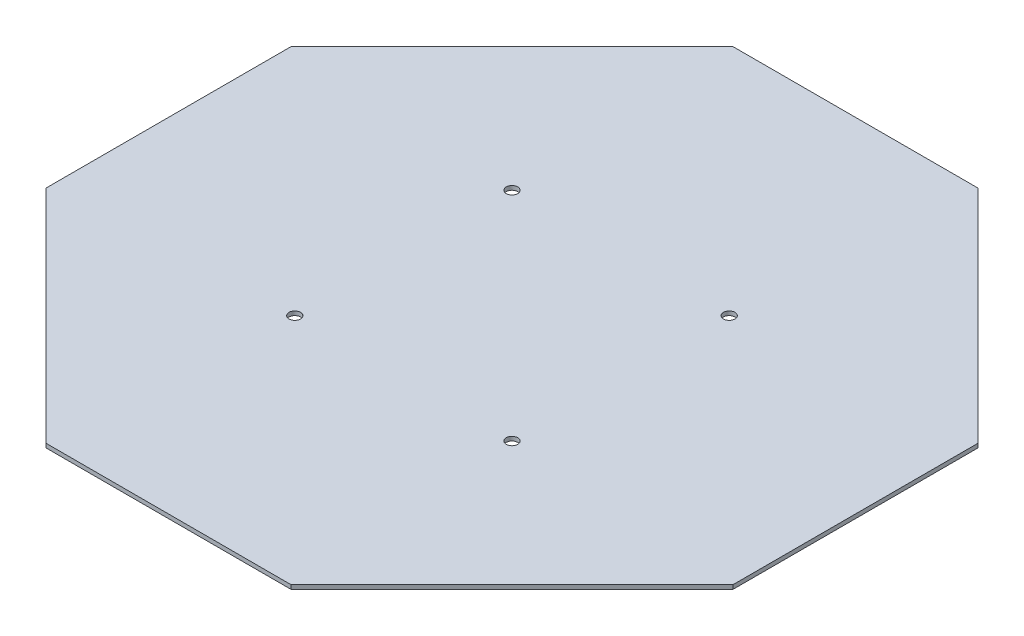
from build123d import *

# Parameters (mm, degrees)
BOSS_EXTRUDE1_DEPTH     = 3
CUT_EXTRUDE1_DEPTH      = 358.808608057
CUT_EXTRUDE1_DEPTH_BACK = 358.808608057
SKETCH2_R               = 4.25


with BuildPart() as part:
    # Sketch1 → Boss-Extrude1 (new body)
    with BuildSketch(Plane(origin=(0, 0, 0), x_dir=(1, 0, 0), z_dir=(0, 1, 0))):
        Polygon((-253, 90.242640687), (-90.242640687, 253), (90.242640687, 253), (253, 90.242640687), (253, -90.242640687), (90.242640687, -253), (-90.242640687, -253), (-253, -90.242640687), align=None)
    extrude(amount=BOSS_EXTRUDE1_DEPTH)

    # Sketch2 → Cut-Extrude1 (cut, two sides: drawn at the far end of the back side and taken through both)
    with BuildSketch(Plane(origin=(0, 3, 0), x_dir=(1, 0, 0), z_dir=(0, 1, 0)).offset(-CUT_EXTRUDE1_DEPTH_BACK)):
        with Locations(Location((-80, 80, 0), (0, 0, 270))):
            Circle(SKETCH2_R)
        with Locations(Location((80, 80, 0), (0, 0, 270))):
            Circle(SKETCH2_R)
        with Locations(Location((80, -80, 0), (0, 0, 270))):
            Circle(SKETCH2_R)
        with Locations(Location((-80, -80, 0), (0, 0, 270))):
            Circle(SKETCH2_R)
    extrude(amount=CUT_EXTRUDE1_DEPTH + CUT_EXTRUDE1_DEPTH_BACK, mode=Mode.SUBTRACT)


solid = part.part
